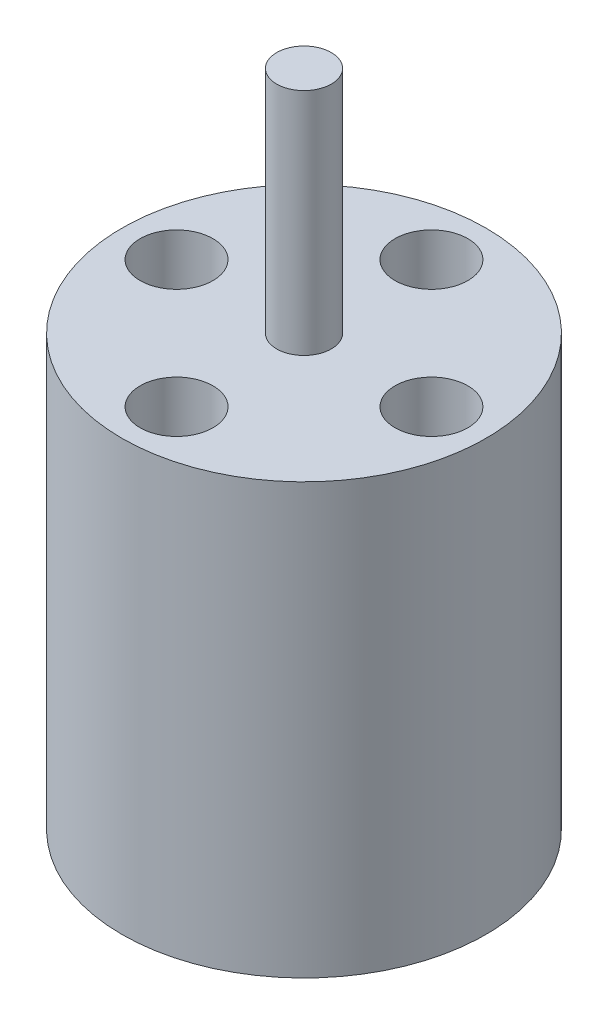
from build123d import *

# Parameters (mm, degrees)
SKETCH_1_R          = 5
EXTRUDE_1_DEPTH     = 11.8
SKETCH_2_R          = 0.75
EXTRUDE_3_DEPTH     = 6.3
SKETCH_4_R          = 1
CUT_EXTRUDE_1_DEPTH = 5


with BuildPart() as part:
    # 草图1 → 凸台-拉伸1 (new body)
    with BuildSketch(Plane(origin=(0, 0, 0), x_dir=(1, 0, 0), z_dir=(0, 1, 0))):
        with Locations(Location((-0.143044278, 0, 0), (0, 0, 270))):
            Circle(SKETCH_1_R)
    extrude(amount=EXTRUDE_1_DEPTH)

    # 草图2 → 凸台-拉伸3 (add)
    with BuildSketch(Plane(origin=(0, 11.8, 0), x_dir=(1, 0, 0), z_dir=(0, 1, 0))):
        with Locations(Location((-0.143044278, 0, 0), (0, 0, 270))):
            Circle(SKETCH_2_R)
    extrude(amount=EXTRUDE_3_DEPTH)

    # 草图4 → 切除-拉伸1 (cut)
    with BuildSketch(Plane(origin=(0, 11.8, 0), x_dir=(1, 0, 0), z_dir=(0, 1, 0))):
        with Locations(Location((-0.143044278, -3.5, 0), (0, 0, 270))):
            Circle(SKETCH_4_R)
        with Locations(Location((-3.643044278, 0, 0), (0, 0, 270))):
            Circle(SKETCH_4_R)
        with Locations(Location((-0.143044278, 3.5, 0), (0, 0, 270))):
            Circle(SKETCH_4_R)
        with Locations(Location((3.356955722, 0, 0), (0, 0, 270))):
            Circle(SKETCH_4_R)
    extrude(amount=-CUT_EXTRUDE_1_DEPTH, mode=Mode.SUBTRACT)


solid = part.part
